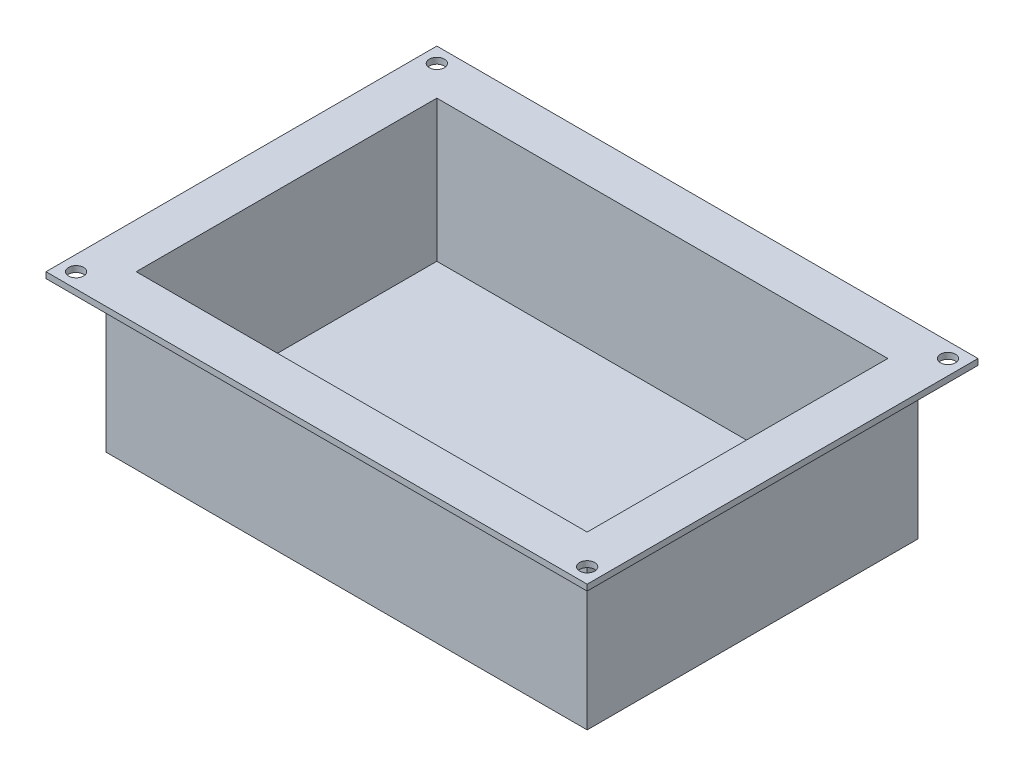
from build123d import *

# Parameters (mm, degrees)
SKETCH1_W                   = 203.2
SKETCH1_H                   = 139.7
BOSS_EXTRUDE2_DEPTH         = 63.5
SKETCH3_W                   = 228.6
SKETCH3_H                   = 165.1
BOSS_EXTRUDE3_DEPTH         = 2.54
F_1_4_0_25_DIAMETER_HOLE1_D = 6.35
SKETCH10_W                  = 190.5
SKETCH10_H                  = 127
CUT_EXTRUDE1_DEPTH          = 59.69


with BuildPart() as part:
    # Sketch1 → Boss-Extrude2 (new body)
    with BuildSketch(Plane(origin=(0, 0, 0), x_dir=(1, 0, 0), z_dir=(0, 1, 0))):
        Rectangle(SKETCH1_W, SKETCH1_H)
    extrude(amount=BOSS_EXTRUDE2_DEPTH)

    # Sketch3 → Boss-Extrude3 (add)
    with BuildSketch(Plane(origin=(0, 63.5, 0), x_dir=(1, 0, 0), z_dir=(0, 1, 0))):
        Rectangle(SKETCH3_W, SKETCH3_H)
    extrude(amount=BOSS_EXTRUDE3_DEPTH)

    # 1/4 (0.25) Diameter Hole1 (through all)
    with Locations(Plane(origin=(107.95, 63.5, -76.2), x_dir=(0, 0, -1), z_dir=(0, -1, 0))):
        with Locations((0, 0), (-152.4, 0), (0, -215.9), (-152.4, -215.9)):
            Hole(F_1_4_0_25_DIAMETER_HOLE1_D / 2)

    # Sketch10 → Cut-Extrude1 (cut)
    with BuildSketch(Plane(origin=(0, 66.04, 0), x_dir=(1, 0, 0), z_dir=(0, 1, 0))):
        Rectangle(SKETCH10_W, SKETCH10_H)
    extrude(amount=-CUT_EXTRUDE1_DEPTH, mode=Mode.SUBTRACT)


solid = part.part
